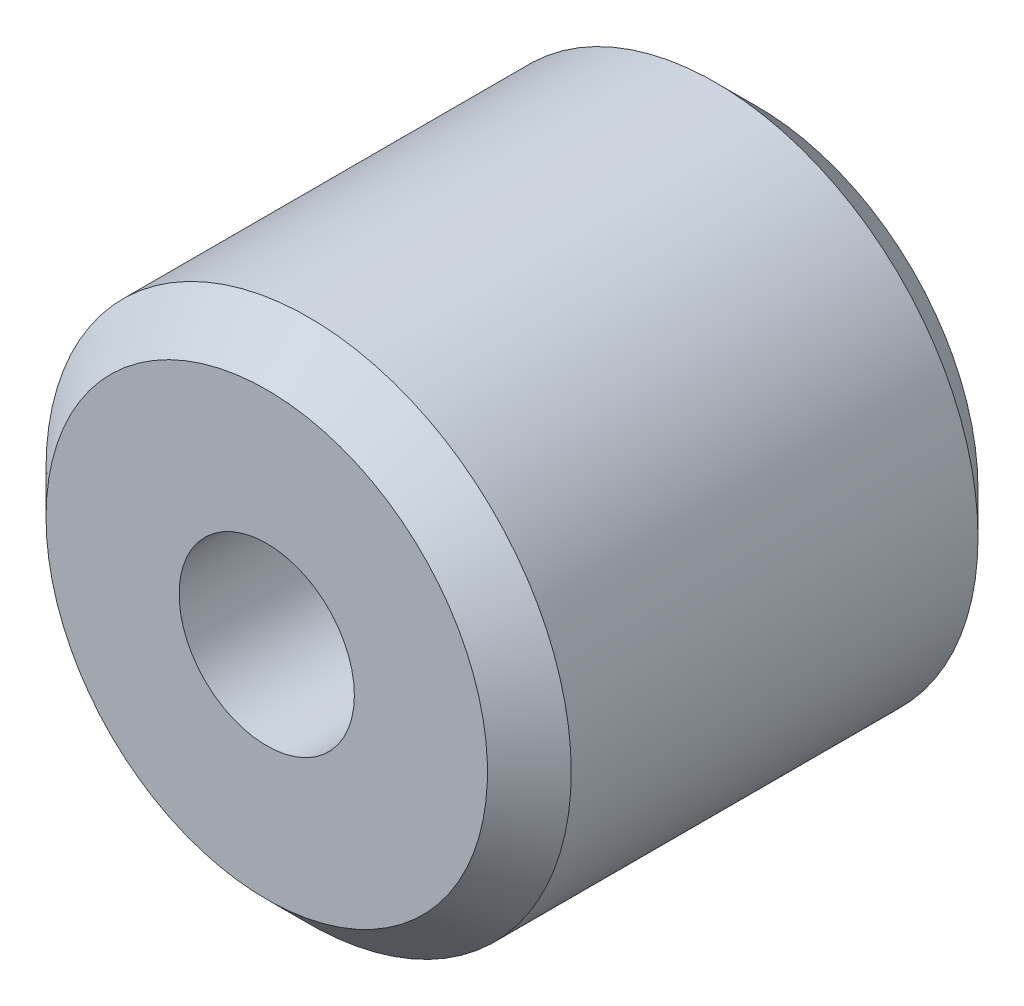
from build123d import *

# Parameters (mm, degrees)
SKETCH1_R               = 4.765
BOSS_EXTRUDE1_DEPTH     = 4.45
CHAMFER1_SIZE           = 0.76
CUT_EXTRUDE1_DEPTH      = 9.075453548
CUT_EXTRUDE1_DEPTH_BACK = 9.075453548
SKETCH2_R               = 1.59


with BuildPart() as part:
    # Sketch1 → Boss-Extrude1 (new, symmetric)
    with BuildSketch(Plane.XY):
        Circle(SKETCH1_R)
    extrude(amount=BOSS_EXTRUDE1_DEPTH, both=True)

    # Chamfer1
    chamfer1_edges = [part.edges().sort_by_distance(p)[0] for p in [
        (-4.765, 0, -4.45),
        (-4.765, 0, 4.45),
    ]]
    chamfer(chamfer1_edges, length=CHAMFER1_SIZE)

    # Sketch2 → Cut-Extrude1 (cut, two sides: drawn at the far end of the back side and taken through both)
    with BuildSketch(Plane.XY.offset(-CUT_EXTRUDE1_DEPTH_BACK)):
        Circle(SKETCH2_R)
    extrude(amount=CUT_EXTRUDE1_DEPTH + CUT_EXTRUDE1_DEPTH_BACK, mode=Mode.SUBTRACT)


solid = part.part
